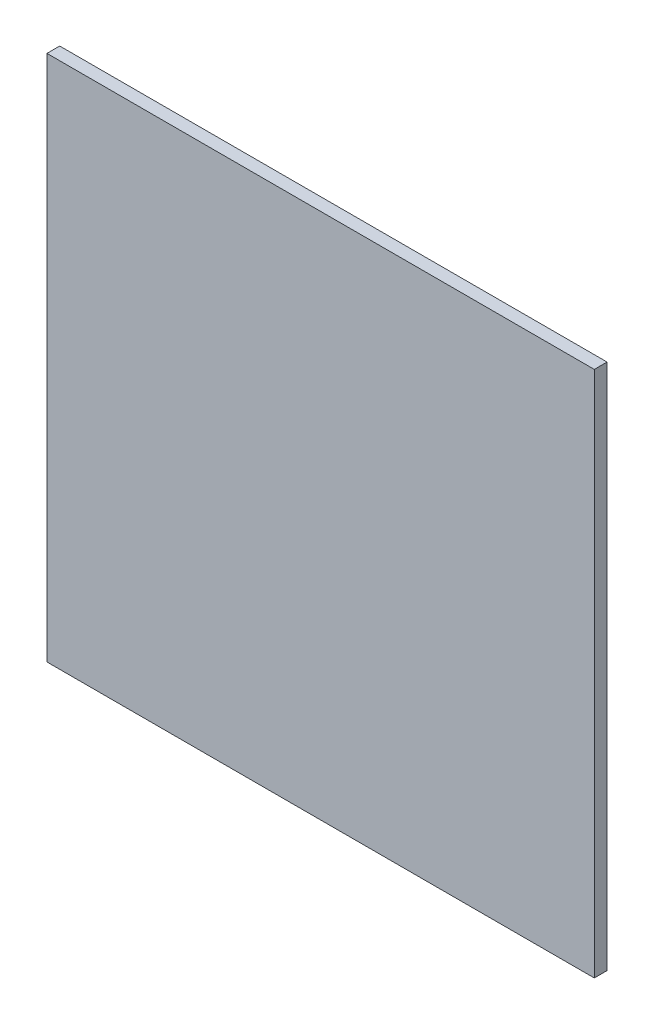
from build123d import *

# Parameters (mm, degrees)
SKETCH1_W           = 68.58
SKETCH1_H           = 66.04
BOSS_EXTRUDE1_DEPTH = 0.8


with BuildPart() as part:
    # Sketch1 → Boss-Extrude1 (new, symmetric)
    with BuildSketch(Plane.XY):
        Rectangle(SKETCH1_W, SKETCH1_H)
    extrude(amount=BOSS_EXTRUDE1_DEPTH, both=True)


solid = part.part
